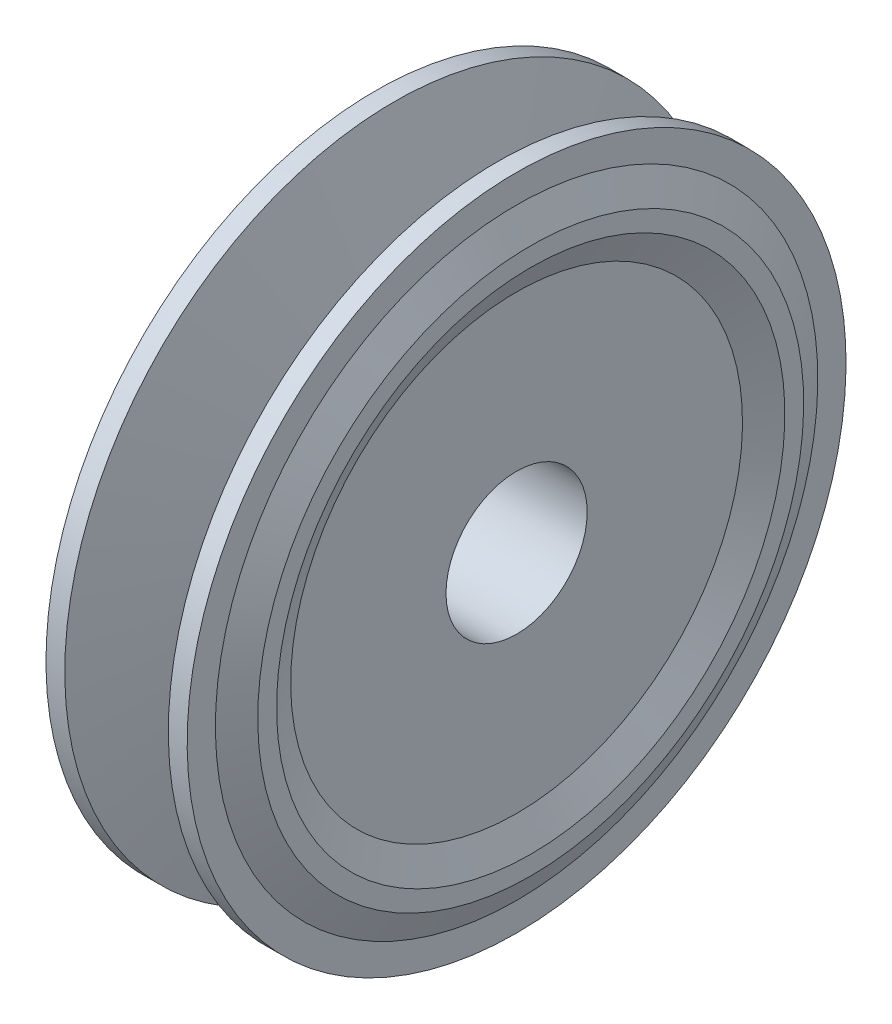
from build123d import *

# Parameters (mm, degrees)
SKETCH_2_R          = 7.5
CUT_EXTRUDE_1_DEPTH = 53.668776329


with BuildPart() as part:
    # Эскиз1 → Повернуть4 (revolve)
    with BuildSketch(Plane.XY, mode=Mode.PRIVATE) as revolve_4_sk:
        Polygon((5.5, 35), (7.5, 35), (7.5, 32), (9, 29), (9, 26.999352312), (7.5, 24), (7.5, 0), (-7.5, 0), (-7.5, 24), (-9, 26.999352312), (-9, 29), (-7.5, 32), (-7.5, 35), (-5.5, 35), (-1.75, 18), (1.75, 18), align=None)
    revolve(revolve_4_sk.sketch.rotate(Axis((0, 0, 0), (1, 0, 0)), 180), axis=Axis((0, 0, 0), (1, 0, 0)))

    # Эскиз2 → Вырез-Вытянуть1 (cut, through all)
    with BuildSketch(Plane(origin=(9, 0, 0), x_dir=(0, 0, -1), z_dir=(1, 0, 0))):
        with Locations(Location((0, 0, 0), (0, 0, 90))):
            Circle(SKETCH_2_R)
    extrude(amount=-CUT_EXTRUDE_1_DEPTH, mode=Mode.SUBTRACT)


solid = part.part
